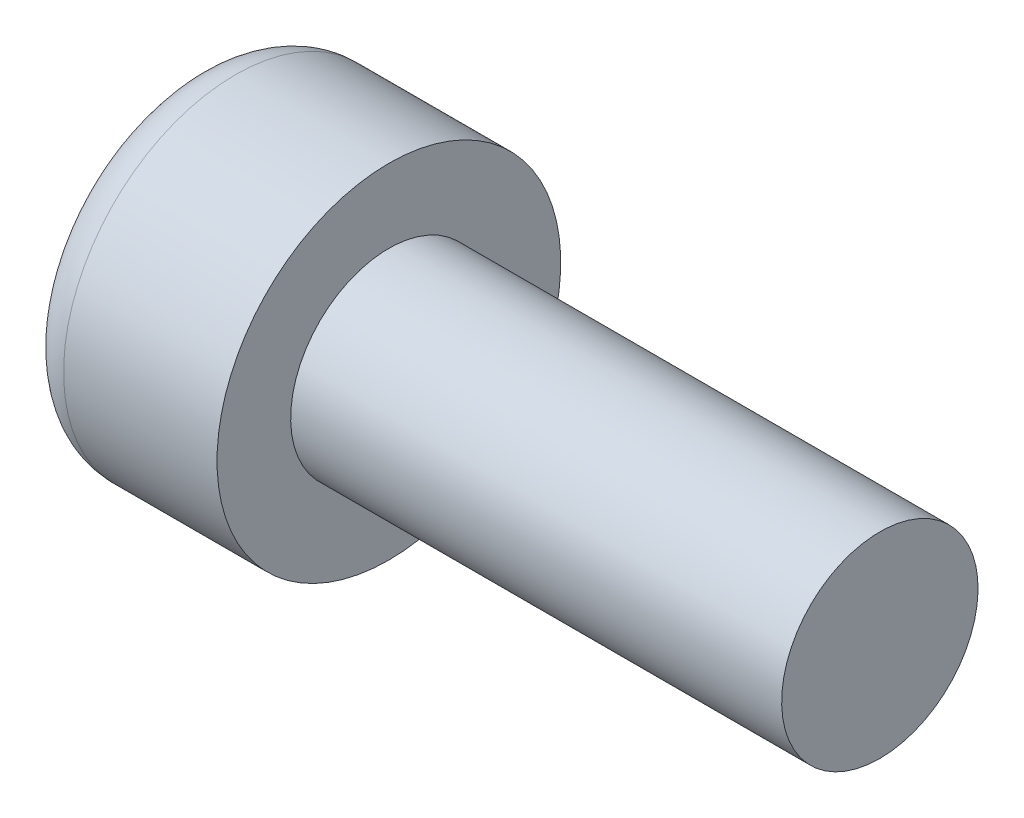
from build123d import *

# Parameters (mm, degrees)
CUT_EXTRUDE1_DEPTH = 2


with BuildPart() as part:
    # Sketch1 → Revolve1 (revolve)
    with BuildSketch(Plane.XY, mode=Mode.PRIVATE) as revolve1_sk:
        with BuildLine():
            Line((0, 0), (0, 2.625))
            ThreePointArc((0, 2.625), (0.256281566, 3.243718434), (0.875, 3.5))
            Line((0.875, 3.5), (4, 3.5))
            Line((4, 3.5), (4, 2))
            Line((4, 2), (14, 2))
            Line((14, 2), (14, 0))
            Line((14, 0), (0, 0))
        make_face()
    revolve(revolve1_sk.sketch.rotate(Axis((0, 0, 0), (1, 0, 0)), 180), axis=Axis((0, 0, 0), (1, 0, 0)))

    # Sketch2 → Cut-Extrude1 (cut)
    with BuildSketch(Plane.ZY):
        Polygon((0, 1.732050808), (-1.5, 0.866025404), (-1.5, -0.866025404), (0, -1.732050808), (1.5, -0.866025404), (1.5, 0.866025404), align=None)
    extrude(amount=-CUT_EXTRUDE1_DEPTH, mode=Mode.SUBTRACT)


solid = part.part
